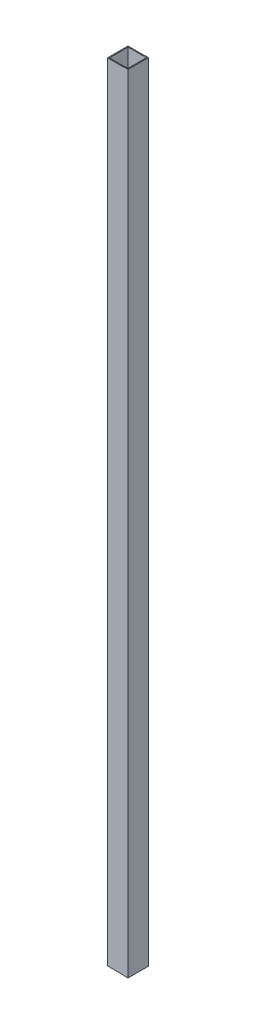
from build123d import *

# Parameters (mm, degrees)
SKETCH1_W           = 50
SKETCH1_H           = 50
SKETCH1_W_2         = 45.6
SKETCH1_H_2         = 45.6
BOSS_EXTRUDE1_DEPTH = 1923
SKETCH2_W           = 40
SKETCH2_H           = 0.5
CUT_EXTRUDE2_DEPTH  = 50


with BuildPart() as part:
    # Sketch1 → Boss-Extrude1 (new body)
    with BuildSketch(Plane(origin=(0, 0, 0), x_dir=(1, 0, 0), z_dir=(0, 1, 0))):
        with Locations((25, 25)):
            Rectangle(SKETCH1_W, SKETCH1_H)
        with Locations((25, 25)):
            Rectangle(SKETCH1_W_2, SKETCH1_H_2, mode=Mode.SUBTRACT)
    extrude(amount=BOSS_EXTRUDE1_DEPTH)

    # Sketch2 → Cut-Extrude2 (cut)
    with BuildSketch(Plane.XY):
        with Locations((20, 0.25)):
            Rectangle(SKETCH2_W, SKETCH2_H)
        with Locations((20, 1922.75)):
            Rectangle(SKETCH2_W, SKETCH2_H)
    extrude(amount=-CUT_EXTRUDE2_DEPTH, mode=Mode.SUBTRACT)


solid = part.part
